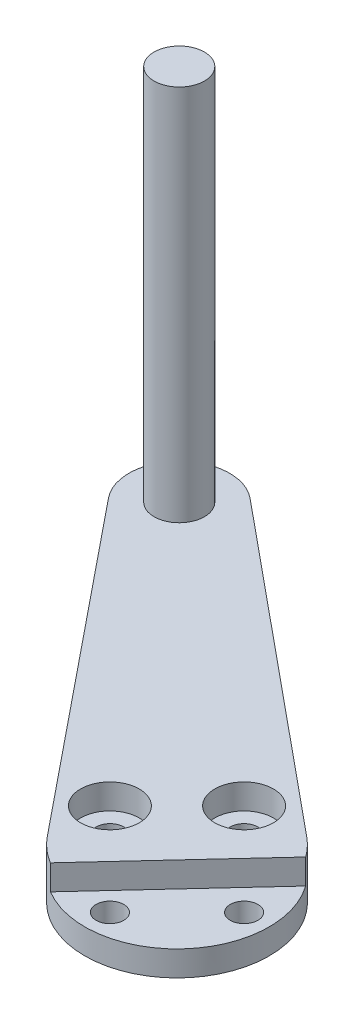
from build123d import *
from build123d.topology import SkipClean

# Parameters (mm, degrees)
SKETCH_1_R        = 11
SKETCH_1_R_2      = 1.65
EXTRUDE_2_DEPTH   = 3
EXTRUDE_3_DEPTH   = 3
EXTRUDE_START     = -6
EXTRUDE_4_DEPTH   = 6
SKETCH_4_R        = 3
EXTRUDE_5_DEPTH   = 45
SKETCH_5_R        = 1.65
EXTRUDE_6_DEPTH   = 5
EXTRUDE_6_2_DEPTH = 5
SKETCH_6_R        = 3.5
EXTRUDE_7_DEPTH   = 4
EXTRUDE_7_2_DEPTH = 4


with BuildPart() as part:
    # 草图1 → 凸台-拉伸2 (new body)
    with BuildSketch(Plane(origin=(0, 0, 0), x_dir=(1, 0, 0), z_dir=(0, 1, 0))):
        Circle(SKETCH_1_R)
        with Locations((0, -8)):
            Circle(SKETCH_1_R_2, mode=Mode.SUBTRACT)
        with Locations((8, 0)):
            Circle(SKETCH_1_R_2, mode=Mode.SUBTRACT)
    extrude(amount=EXTRUDE_2_DEPTH)

    # 草图2 → 凸台-拉伸3 (add)
    with SkipClean():  # the faces are left unmerged after this step: merging them gives an invalid solid
        with BuildSketch(Plane(origin=(0, 3, 0), x_dir=(1, 0, 0), z_dir=(0, 1, 0))):
            with BuildLine():
                Line((8.952279946, 6.391923323), (-5.663051219, -9.430262504))
                ThreePointArc((-5.663051219, -9.430262504), (-8.080231896, 7.463903303), (8.952279946, 6.391923323))
            make_face()
        extrude(amount=EXTRUDE_3_DEPTH)

    # 草图3 → 凸台-拉伸4 (add)
    with BuildSketch(Plane(origin=(0, 6, 0), x_dir=(1, 0, 0), z_dir=(0, 1, 0)).offset(EXTRUDE_START)):
        with BuildLine():
            Line((-5.663051219, -9.430262504), (8.952279946, 6.391923323))
            ThreePointArc((8.952279946, 6.391923323), (8.041723321, 7.505377141), (6.993667, 8.490501863))
            Line((6.993667, 8.490501863), (-31.406072494, 40.120550975))
            ThreePointArc((-31.406072494, 40.120550975), (-39.447295943, 39.748092317), (-39.880826602, 31.709930141))
            Line((-39.880826602, 31.709930141), (-8.543382198, -6.928969665))
            ThreePointArc((-8.543382198, -6.928969665), (-7.212475586, -8.305431712), (-5.663051219, -9.430262504))
        make_face()
    extrude(amount=EXTRUDE_4_DEPTH)

    # 草图4 → 凸台-拉伸5 (add)
    with BuildSketch(Plane(origin=(0, 6, 0), x_dir=(1, 0, 0), z_dir=(0, 1, 0))):
        with Locations((-35.220799949, 35.48936814)):
            Circle(SKETCH_4_R)
    extrude(amount=EXTRUDE_5_DEPTH)


with BuildPart() as body_2:
    # 草图5 → 凸台-拉伸6 (new, symmetric)
    with BuildSketch(Plane(origin=(0, 3, 0), x_dir=(1, 0, 0), z_dir=(0, 1, 0))):
        with Locations((-8, 0)):
            Circle(SKETCH_5_R)
    extrude(amount=EXTRUDE_6_DEPTH, both=True)


with BuildPart() as body_3:
    # 草图5 → Extrude 6 2 (new, symmetric)
    with BuildSketch(Plane(origin=(0, 3, 0), x_dir=(1, 0, 0), z_dir=(0, 1, 0))):
        with Locations((0, 8)):
            Circle(SKETCH_5_R)
    extrude(amount=EXTRUDE_6_2_DEPTH, both=True)


with BuildPart() as part_1:
    add(part.part)

    # Combine 1: cut body 3, body 2
    add(body_3.part, mode=Mode.SUBTRACT)
    add(body_2.part, mode=Mode.SUBTRACT)


with BuildPart() as body_2_2:
    # 草图6 → 凸台-拉伸7 (new body)
    with BuildSketch(Plane(origin=(0, 3, 0), x_dir=(1, 0, 0), z_dir=(0, 1, 0))):
        with Locations((0, 8)):
            Circle(SKETCH_6_R)
    extrude(amount=EXTRUDE_7_DEPTH)


with BuildPart() as body_3_2:
    # 草图6 → Extrude 7 2 (new body)
    with BuildSketch(Plane(origin=(0, 3, 0), x_dir=(1, 0, 0), z_dir=(0, 1, 0))):
        with Locations((-8, 0)):
            Circle(SKETCH_6_R)
    extrude(amount=EXTRUDE_7_2_DEPTH)


with BuildPart() as part_2:
    add(part_1.part)

    # Combine 2: cut body 2 2, body 3 2
    add(body_2_2.part, mode=Mode.SUBTRACT)
    add(body_3_2.part, mode=Mode.SUBTRACT)


solid = part_2.part
